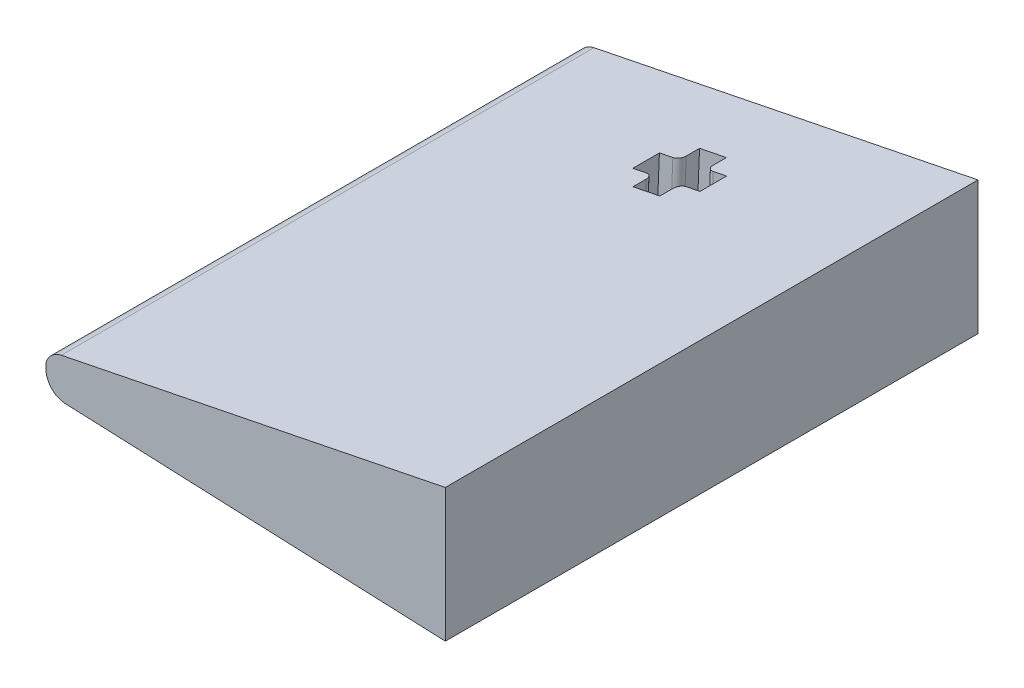
from build123d import *

# Parameters (mm, degrees)
BOSS_EXTRUDE1_DEPTH = 40
CUT_EXTRUDE1_DEPTH  = 239


with BuildPart() as part:
    # Sketch1 → Boss-Extrude1 (new body)
    with BuildSketch(Plane.XY):
        with BuildLine():
            Line((30.047665389, 0), (30.047665389, 5.358567608))
            Line((30.047665389, 5.358567608), (1.215039634, -0.459096075))
            ThreePointArc((1.215039634, -0.459096075), (0.492690836, -0.825874412), (0.062707817, -1.512481095))
            Line((0.062707817, -1.512481095), (0.062707817, -1.945783899))
            ThreePointArc((0.062707817, -1.945783899), (0.484381365, -2.994370603), (1.514610899, -3.459096075))
            Line((1.514610899, -3.459096075), (30.047665389, -4.641432392))
            Line((30.047665389, -4.641432392), (30.047665389, 0))
        make_face()
    extrude(amount=BOSS_EXTRUDE1_DEPTH)

    # Sketch5 → Cut-Extrude1 (cut)
    with BuildSketch(Plane(origin=(-0.140494121, -3.390512784, 0), x_dir=(0.99914257391908, -0.04140189587876196, 0), z_dir=(-0.04140189587876195, -0.9991425739190799, 0))):
        with BuildLine():
            Line((16.27382087, 5.238645278), (16.27382087, 6.238645278))
            ThreePointArc((16.27382087, 6.238645278), (16.420267479, 6.592198669), (16.77382087, 6.738645278))
            Line((16.77382087, 6.738645278), (17.77382087, 6.738645278))
            Line((17.77382087, 6.738645278), (17.77382087, 7.738645278))
            Line((17.77382087, 7.738645278), (17.77382087, 8.738645278))
            Line((17.77382087, 8.738645278), (16.77382087, 8.738645278))
            ThreePointArc((16.77382087, 8.738645278), (16.420267479, 8.885091887), (16.27382087, 9.238645278))
            Line((16.27382087, 9.238645278), (16.27382087, 10.238645278))
            Line((16.27382087, 10.238645278), (14.27382087, 10.238645278))
            Line((14.27382087, 10.238645278), (14.27382087, 9.238645278))
            ThreePointArc((14.27382087, 9.238645278), (14.12737426, 8.885091887), (13.77382087, 8.738645278))
            Line((13.77382087, 8.738645278), (12.77382087, 8.738645278))
            Line((12.77382087, 8.738645278), (12.77382087, 6.738645278))
            Line((12.77382087, 6.738645278), (13.77382087, 6.738645278))
            ThreePointArc((13.77382087, 6.738645278), (14.12737426, 6.592198669), (14.27382087, 6.238645278))
            Line((14.27382087, 6.238645278), (14.27382087, 5.238645278))
            Line((14.27382087, 5.238645278), (15.27382087, 5.238645278))
            Line((15.27382087, 5.238645278), (16.27382087, 5.238645278))
        make_face()
    extrude(amount=-CUT_EXTRUDE1_DEPTH, mode=Mode.SUBTRACT)


solid = part.part
